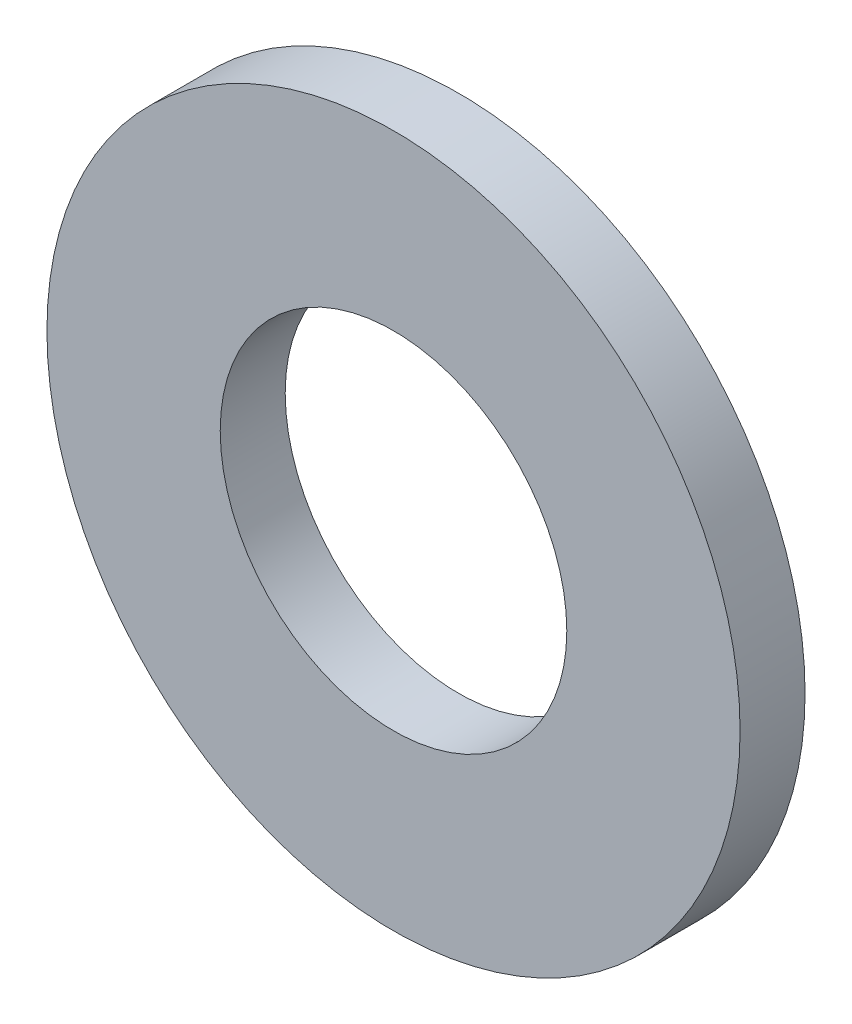
from build123d import *

# Parameters (mm, degrees)
ESQUISSE1_R          = 8
ESQUISSE1_R_2        = 4
BASE_EXTRUSION_DEPTH = 1.5


with BuildPart() as part:
    # Esquisse1 → Base-Extrusion (new body)
    with BuildSketch(Plane.XY):
        Circle(ESQUISSE1_R)
        Circle(ESQUISSE1_R_2, mode=Mode.SUBTRACT)
    extrude(amount=BASE_EXTRUSION_DEPTH)


solid = part.part
